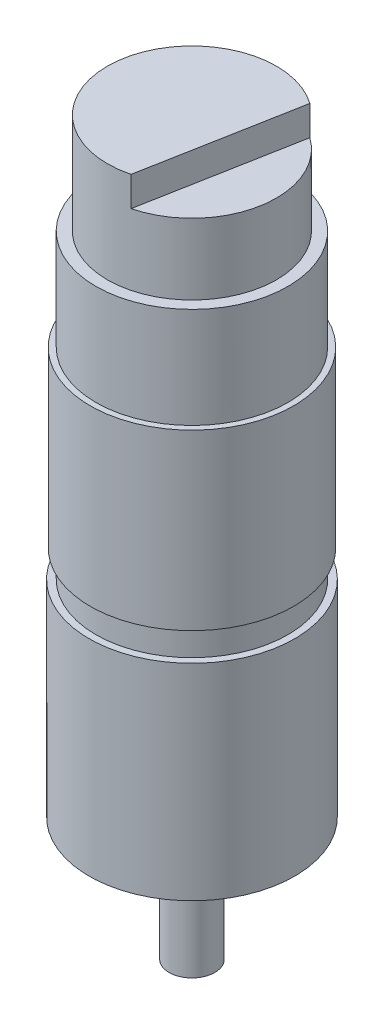
from build123d import *

# Parameters (mm, degrees)
SKETCH5_R            = 22.5
BOSS_EXTRUDE4_DEPTH  = 45
SKETCH6_R            = 21
BOSS_EXTRUDE5_DEPTH  = 6
SKETCH7_R            = 22.25
BOSS_EXTRUDE6_DEPTH  = 38
SKETCH8_R            = 21
BOSS_EXTRUDE7_DEPTH  = 22
SKETCH9_R            = 18.5
BOSS_EXTRUDE9_DEPTH  = 22
CUT_EXTRUDE1_START   = -6.5
CUT_EXTRUDE1_DEPTH   = 6.5
CUT_EXTRUDE3_START   = -38
CUT_EXTRUDE3_DEPTH   = 38
BOSS_EXTRUDE11_DEPTH = 2
SKETCH19_R           = 5
BOSS_EXTRUDE12_DEPTH = 25
CUT_EXTRUDE4_DEPTH   = 10


with BuildPart() as part:
    # Sketch5 → Boss-Extrude4 (new body)
    with BuildSketch(Plane(origin=(0, 0, 0), x_dir=(1, 0, 0), z_dir=(0, 1, 0))):
        with Locations(Location((0, 0, 0), (0, 0, 90))):
            Circle(SKETCH5_R)
    extrude(amount=BOSS_EXTRUDE4_DEPTH)

    # Sketch6 → Boss-Extrude5 (add)
    with BuildSketch(Plane(origin=(0, 45, 0), x_dir=(-1, 0, 0), z_dir=(0, 1, 0))):
        with Locations(Location((0, 0, 0), (0, 0, 90))):
            Circle(SKETCH6_R)
    extrude(amount=BOSS_EXTRUDE5_DEPTH)

    # Sketch7 → Boss-Extrude6 (add)
    with BuildSketch(Plane(origin=(0, 51, 0), x_dir=(-1, 0, 0), z_dir=(0, 1, 0))):
        with Locations(Location((0, 0, 0), (0, 0, 90))):
            Circle(SKETCH7_R)
    extrude(amount=BOSS_EXTRUDE6_DEPTH)

    # Sketch8 → Boss-Extrude7 (add)
    with BuildSketch(Plane(origin=(0, 89, 0), x_dir=(-1, 0, 0), z_dir=(0, 1, 0))):
        with Locations(Location((0, 0, 0), (0, 0, 90))):
            Circle(SKETCH8_R)
    extrude(amount=BOSS_EXTRUDE7_DEPTH)

    # Sketch9 → Boss-Extrude9 (add)
    with BuildSketch(Plane(origin=(0, 111, 0), x_dir=(-1, 0, 0), z_dir=(0, 1, 0))):
        with Locations(Location((0, 0, 0), (0, 0, 90))):
            Circle(SKETCH9_R)
    extrude(amount=BOSS_EXTRUDE9_DEPTH)

    # Sketch10 → Cut-Extrude1 (cut)
    with BuildSketch(Plane(origin=(0, 133, 0), x_dir=(-1, 0, 0), z_dir=(0, 1, 0)).offset(CUT_EXTRUDE1_START)):
        with BuildLine():
            Line((-10.71607179, -15.080311847), (-4.597257497, 17.919688153))
            ThreePointArc((-4.597257497, 17.919688153), (-18.18995639, 3.372756519), (-10.71607179, -15.080311847))
        make_face()
    extrude(amount=CUT_EXTRUDE1_DEPTH, mode=Mode.SUBTRACT)

    # Sketch16 → Cut-Extrude3 (cut)
    with BuildSketch(Plane(origin=(0, 89, 0), x_dir=(1, 0, 0), z_dir=(0, 1, 0)).offset(CUT_EXTRUDE3_START)):
        with BuildLine():
            Line((0.651202062, 20.989900807), (0.68996409, 22.239299664))
            ThreePointArc((0.68996409, 22.239299664), (3.931001005, 21.899993861), (7.087715105, 21.090917348))
            Line((7.087715105, 21.090917348), (6.689528863, 19.906034351))
            ThreePointArc((6.689528863, 19.906034351), (3.710158252, 20.669657127), (0.651202062, 20.989900807))
        make_face()
    extrude(amount=CUT_EXTRUDE3_DEPTH, mode=Mode.SUBTRACT)

    # Sketch17 → Boss-Extrude11 (add)
    with BuildSketch(Plane.XZ):
        with BuildLine():
            ThreePointArc((-5, 12), (-13, 0), (-5, -12))
            Line((-5, -12), (5, -12))
            ThreePointArc((5, -12), (10.816653826, -7.211102551), (13, 0))
            ThreePointArc((13, 0), (10.816653826, 7.211102551), (5, 12))
            Line((5, 12), (-5, 12))
        make_face()
    extrude(amount=BOSS_EXTRUDE11_DEPTH)

    # Sketch19 → Boss-Extrude12 (add)
    with BuildSketch(Plane.XZ.offset(2)):
        with Locations(Location((0, 0, 0), (0, 0, 270))):
            Circle(SKETCH19_R)
    extrude(amount=BOSS_EXTRUDE12_DEPTH)

    # Sketch20 → Cut-Extrude4 (cut)
    with BuildSketch(Plane.XZ):
        with BuildLine():
            ThreePointArc((-10.577989001, 12.167341234), (-13.992202563, 13.581554796), (-12.577989001, 10.167341234))
            Line((-12.577989001, 10.167341234), (-12.577989001, 12.167341234))
            Line((-12.577989001, 12.167341234), (-10.577989001, 12.167341234))
        make_face()
        with BuildLine():
            Line((-12.577989001, 12.167341234), (-12.577989001, 10.167341234))
            ThreePointArc((-12.577989001, 10.167341234), (-11.163775438, 10.753127672), (-10.577989001, 12.167341234))
            Line((-10.577989001, 12.167341234), (-12.577989001, 12.167341234))
        make_face()
        with BuildLine():
            Line((-12.577989001, -10.167341234), (-12.577989001, -12.167341234))
            Line((-12.577989001, -12.167341234), (-10.577989001, -12.167341234))
            ThreePointArc((-10.577989001, -12.167341234), (-11.163775438, -10.753127672), (-12.577989001, -10.167341234))
        make_face()
        with BuildLine():
            Line((-10.577989001, -12.167341234), (-12.577989001, -12.167341234))
            Line((-12.577989001, -12.167341234), (-12.577989001, -10.167341234))
            ThreePointArc((-12.577989001, -10.167341234), (-13.992202563, -13.581554796), (-10.577989001, -12.167341234))
        make_face()
        with BuildLine():
            ThreePointArc((12.577989001, -10.167341234), (11.163775438, -10.753127672), (10.577989001, -12.167341234))
            Line((10.577989001, -12.167341234), (12.577989001, -12.167341234))
            Line((12.577989001, -12.167341234), (12.577989001, -10.167341234))
        make_face()
        with BuildLine():
            Line((12.577989001, -12.167341234), (10.577989001, -12.167341234))
            ThreePointArc((10.577989001, -12.167341234), (12.577989001, -14.167341234), (14.577989001, -12.167341234))
            ThreePointArc((14.577989001, -12.167341234), (13.992202563, -10.753127672), (12.577989001, -10.167341234))
            Line((12.577989001, -10.167341234), (12.577989001, -12.167341234))
        make_face()
        with BuildLine():
            ThreePointArc((10.577989001, 12.167341234), (11.163775438, 10.753127672), (12.577989001, 10.167341234))
            Line((12.577989001, 10.167341234), (12.577989001, 12.167341234))
            Line((12.577989001, 12.167341234), (10.577989001, 12.167341234))
        make_face()
        with BuildLine():
            Line((12.577989001, 12.167341234), (12.577989001, 10.167341234))
            ThreePointArc((12.577989001, 10.167341234), (13.992202563, 10.753127672), (14.577989001, 12.167341234))
            ThreePointArc((14.577989001, 12.167341234), (12.577989001, 14.167341234), (10.577989001, 12.167341234))
            Line((10.577989001, 12.167341234), (12.577989001, 12.167341234))
        make_face()
    extrude(amount=-CUT_EXTRUDE4_DEPTH, mode=Mode.SUBTRACT)


solid = part.part
